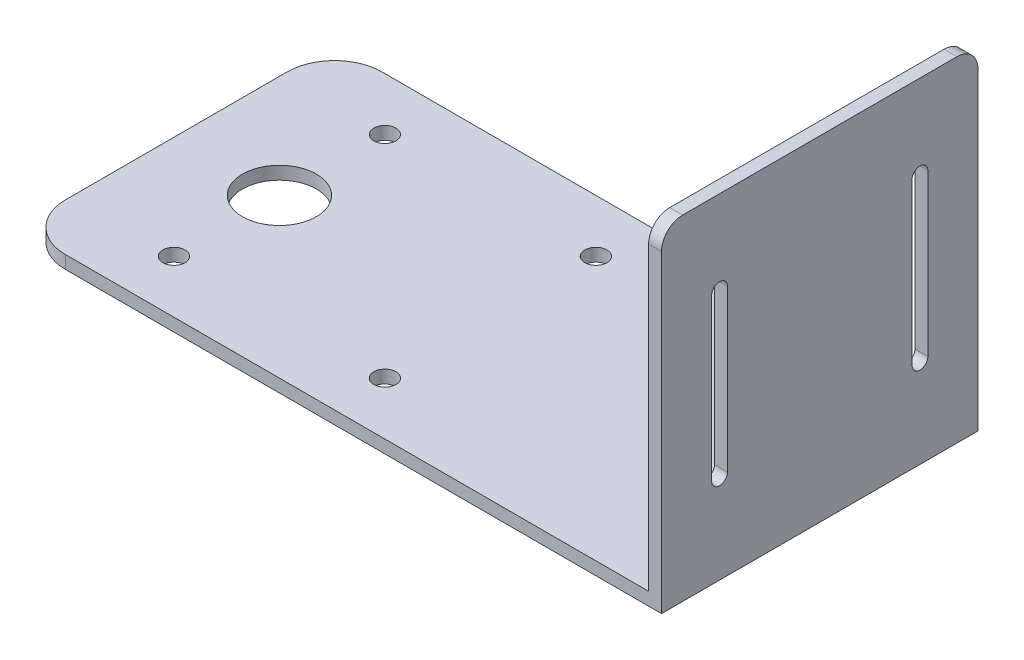
from build123d import *

# Parameters (mm, degrees)
SKETCH_1_W          = 122
SKETCH_1_H          = 60
SKETCH_1_R          = 7
SKETCH_1_R_2        = 2.1
EXTRUDE_1_DEPTH     = 2.45
FILLET_1_R          = 9
SKETCH_2_W          = 2.45
SKETCH_2_H          = 60
EXTRUDE_2_DEPTH     = 61
FILLET_2_R          = 4
CUT_EXTRUDE_1_DEPTH = 61


with BuildPart() as part:
    # 草图1 → 凸台-拉伸1 (new body)
    with BuildSketch(Plane(origin=(0, 0, 0), x_dir=(1, 0, 0), z_dir=(0, 1, 0))):
        Rectangle(SKETCH_1_W, SKETCH_1_H)
        with Locations(Location((-41.45, 0, 0), (0, 0, 270))):
            Circle(SKETCH_1_R, mode=Mode.SUBTRACT)
        with Locations(Location((-41.45, 20, 0), (0, 0, 270))):
            Circle(SKETCH_1_R_2, mode=Mode.SUBTRACT)
        with Locations(Location((-1.45, 20, 0), (0, 0, 270))):
            Circle(SKETCH_1_R_2, mode=Mode.SUBTRACT)
        with Locations(Location((-1.45, -20, 0), (0, 0, 270))):
            Circle(SKETCH_1_R_2, mode=Mode.SUBTRACT)
        with Locations(Location((-41.45, -20, 0), (0, 0, 270))):
            Circle(SKETCH_1_R_2, mode=Mode.SUBTRACT)
    extrude(amount=EXTRUDE_1_DEPTH)

    # 圆角1
    fillet_1_edges = [part.edges().sort_by_distance(p)[0] for p in [
        (-61, 1.225, -30),
        (-61, 1.225, 30),
    ]]
    fillet(fillet_1_edges, radius=FILLET_1_R)

    # 草图2 → 凸台-拉伸2 (add)
    with BuildSketch(Plane(origin=(0, 2.45, 0), x_dir=(1, 0, 0), z_dir=(0, 1, 0))):
        with Locations((59.775, 0)):
            Rectangle(SKETCH_2_W, SKETCH_2_H)
    extrude(amount=EXTRUDE_2_DEPTH)

    # 圆角2
    fillet_2_edges = [part.edges().sort_by_distance(p)[0] for p in [
        (59.775, 63.45, -30),
        (59.775, 63.45, 30),
    ]]
    fillet(fillet_2_edges, radius=FILLET_2_R)

    # 草图3 → 切除-拉伸1 (cut)
    with BuildSketch(Plane.ZY.offset(-58.55)):
        with BuildLine():
            Line((-20.5, 47.5), (-20.5, 17))
            ThreePointArc((-20.5, 17), (-19, 15.5), (-17.5, 17))
            Line((-17.5, 17), (-17.5, 47.5))
            ThreePointArc((-17.5, 47.5), (-19, 49), (-20.5, 47.5))
        make_face()
        with BuildLine():
            Line((17.5, 47.5), (17.5, 17))
            ThreePointArc((17.5, 17), (19, 15.5), (20.5, 17))
            Line((20.5, 17), (20.5, 47.5))
            ThreePointArc((20.5, 47.5), (19, 49), (17.5, 47.5))
        make_face()
    extrude(amount=-CUT_EXTRUDE_1_DEPTH, mode=Mode.SUBTRACT)


solid = part.part
